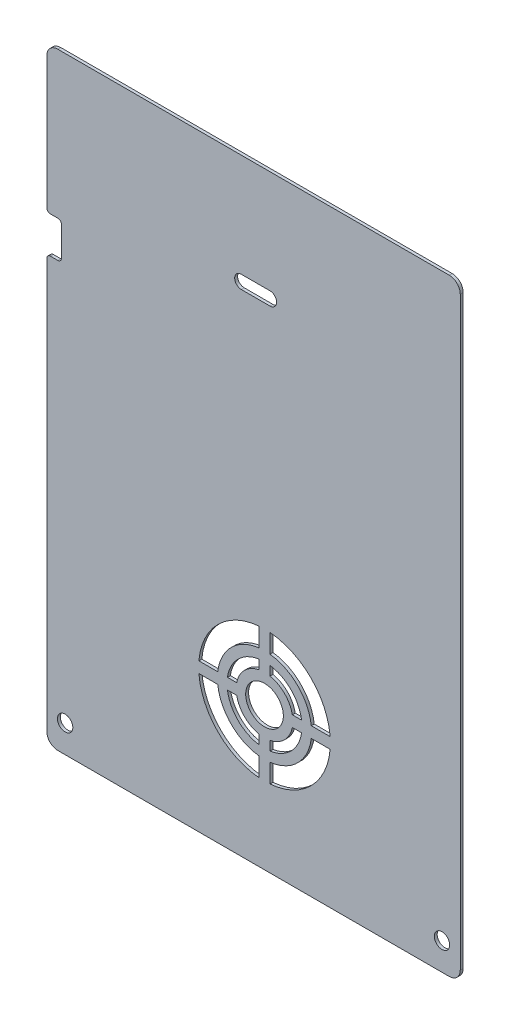
from build123d import *

# Parameters (mm, degrees)
SALIENTE_EXTRUIR1_DEPTH = 0.8
CROQUIS5_R              = 5.15
CORTAR_EXTRUIR1_DEPTH   = 0.8
CROQUIS4_R              = 2.1
CORTAR_EXTRUIR2_DEPTH   = 0.8


with BuildPart() as part:
    # Croquis1 → Saliente-Extruir1 (new body)
    with BuildSketch(Plane.XY):
        with BuildLine():
            Line((-55.5, 86), (-55.5, 78))
            ThreePointArc((-55.5, 78), (-55.792893219, 77.292893219), (-56.5, 77))
            Line((-56.5, 77), (-58.5, 77))
            ThreePointArc((-58.5, 77), (-59.207106781, 76.707106781), (-59.5, 76))
            Line((-59.5, 76), (-59.5, -36))
            ThreePointArc((-59.5, -36), (-58.621320344, -38.121320344), (-56.5, -39))
            Line((-56.5, -39), (50.5, -39))
            ThreePointArc((50.5, -39), (52.621320344, -38.121320344), (53.5, -36))
            Line((53.5, -36), (53.5, 124))
            ThreePointArc((53.5, 124), (52.621320344, 126.121320344), (50.5, 127))
            Line((50.5, 127), (-56.5, 127))
            ThreePointArc((-56.5, 127), (-58.621320344, 126.121320344), (-59.5, 124))
            Line((-59.5, 124), (-59.5, 88))
            ThreePointArc((-59.5, 88), (-59.207106781, 87.292893219), (-58.5, 87))
            Line((-58.5, 87), (-56.5, 87))
            ThreePointArc((-56.5, 87), (-55.792893219, 86.707106781), (-55.5, 86))
        make_face()
    extrude(amount=SALIENTE_EXTRUIR1_DEPTH)

    # Croquis5 → Cortar-Extruir1 (cut)
    with BuildSketch(Plane.XY.offset(0.8)):
        Circle(CROQUIS5_R)
        with BuildLine():
            Line((-17.937391115, -1.5), (-12.787322824, -1.5))
            ThreePointArc((-12.787322824, -1.5), (-9.103999808, -9.103999808), (-1.5, -12.787322824))
            Line((-1.5, -12.787322824), (-1.5, -17.937391115))
            ThreePointArc((-1.5, -17.937391115), (-12.727922061, -12.727922061), (-17.937391115, -1.5))
        make_face()
        with BuildLine():
            Line((-17.937391115, 1.5), (-12.787322824, 1.5))
            ThreePointArc((-12.787322824, 1.5), (-9.103999808, 9.103999808), (-1.5, 12.787322824))
            Line((-1.5, 12.787322824), (-1.5, 17.937391115))
            ThreePointArc((-1.5, 17.937391115), (-12.727922061, 12.727922061), (-17.937391115, 1.5))
        make_face()
        with BuildLine():
            Line((1.5, -17.937391115), (1.5, -12.787322824))
            ThreePointArc((1.5, -12.787322824), (9.103999808, -9.103999808), (12.787322824, -1.5))
            Line((12.787322824, -1.5), (17.937391115, -1.5))
            ThreePointArc((17.937391115, -1.5), (12.727922061, -12.727922061), (1.5, -17.937391115))
        make_face()
        with BuildLine():
            Line((-10.139649895, 1.5), (-7.603453163, 1.5))
            ThreePointArc((-7.603453163, 1.5), (-5.480077554, 5.480077554), (-1.5, 7.603453163))
            Line((-1.5, 7.603453163), (-1.5, 10.139649895))
            ThreePointArc((-1.5, 10.139649895), (-7.247844507, 7.247844507), (-10.139649895, 1.5))
        make_face()
        with BuildLine():
            Line((-10.139649895, -1.5), (-7.603453163, -1.5))
            ThreePointArc((-7.603453163, -1.5), (-5.480077554, -5.480077554), (-1.5, -7.603453163))
            Line((-1.5, -7.603453163), (-1.5, -10.139649895))
            ThreePointArc((-1.5, -10.139649895), (-7.247844507, -7.247844507), (-10.139649895, -1.5))
        make_face()
        with BuildLine():
            Line((7.603453163, -1.5), (10.139649895, -1.5))
            ThreePointArc((10.139649895, -1.5), (7.247844507, -7.247844507), (1.5, -10.139649895))
            Line((1.5, -10.139649895), (1.5, -7.603453163))
            ThreePointArc((1.5, -7.603453163), (5.480077554, -5.480077554), (7.603453163, -1.5))
        make_face()
        with BuildLine():
            Line((7.603453163, 1.5), (10.139649895, 1.5))
            ThreePointArc((10.139649895, 1.5), (7.247844507, 7.247844507), (1.5, 10.139649895))
            Line((1.5, 10.139649895), (1.5, 7.603453163))
            ThreePointArc((1.5, 7.603453163), (5.480077554, 5.480077554), (7.603453163, 1.5))
        make_face()
        with BuildLine():
            Line((12.787322824, 1.5), (17.937391115, 1.5))
            ThreePointArc((17.937391115, 1.5), (12.727922061, 12.727922061), (1.5, 17.937391115))
            Line((1.5, 17.937391115), (1.5, 12.787322824))
            ThreePointArc((1.5, 12.787322824), (9.103999808, 9.103999808), (12.787322824, 1.5))
        make_face()
    extrude(amount=-CORTAR_EXTRUIR1_DEPTH, mode=Mode.SUBTRACT)

    # Croquis4 → Cortar-Extruir2 (cut)
    with BuildSketch(Plane.XY.offset(0.8)):
        with Locations((-54.5, -31.5)):
            Circle(CROQUIS4_R)
        with Locations((48.5, -31.5)):
            Circle(CROQUIS4_R)
        with BuildLine():
            Line((-6.348885271, 98.8), (1.5, 98.8))
            ThreePointArc((1.5, 98.8), (3.3, 97), (1.5, 95.2))
            Line((1.5, 95.2), (-6.348885271, 95.2))
            ThreePointArc((-6.348885271, 95.2), (-8.148885271, 97), (-6.348885271, 98.8))
        make_face()
    extrude(amount=-CORTAR_EXTRUIR2_DEPTH, mode=Mode.SUBTRACT)


solid = part.part
